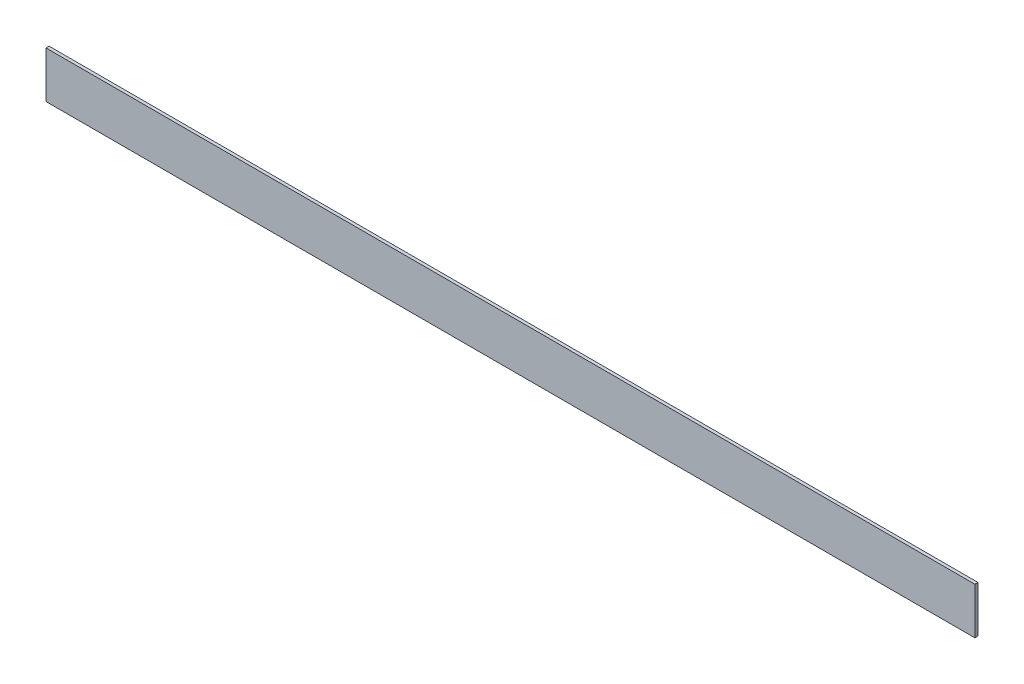
from build123d import *

# Parameters (mm, degrees)
ESQUISSE1_W        = 600
ESQUISSE1_H        = 30
BOSS_EXTRU_1_DEPTH = 2


with BuildPart() as part:
    # Esquisse1 → Boss.-Extru.1 (new body)
    with BuildSketch(Plane.XY):
        with Locations((300, 15)):
            Rectangle(ESQUISSE1_W, ESQUISSE1_H)
    extrude(amount=BOSS_EXTRU_1_DEPTH)


solid = part.part
